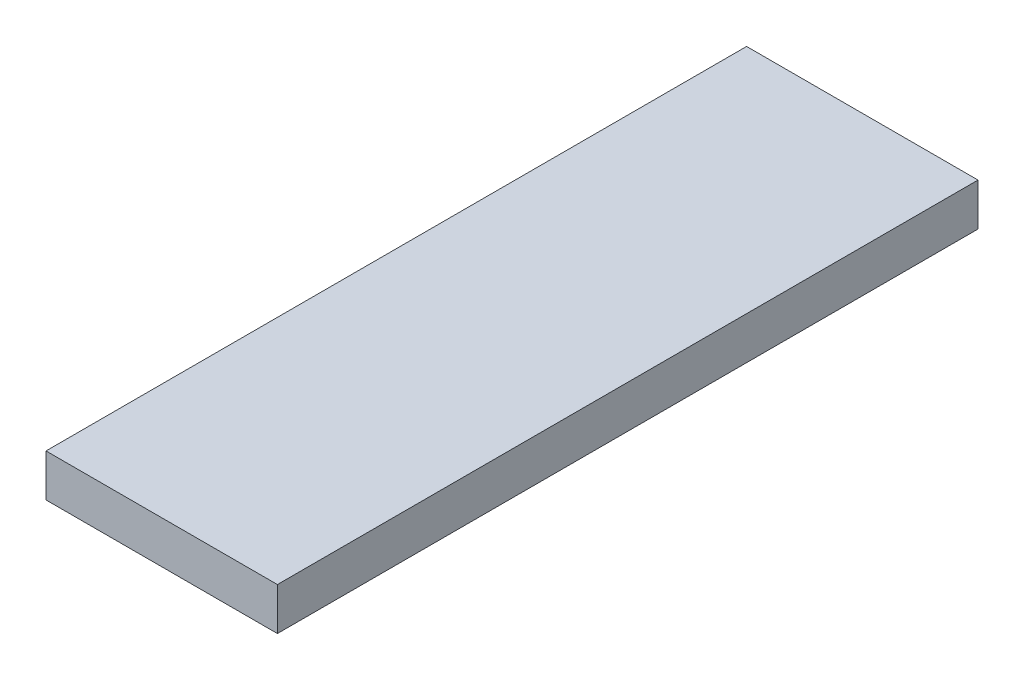
from build123d import *

# Parameters (mm, degrees)
SKETCH1_W           = 54.5
SKETCH1_H           = 165
BOSS_EXTRUDE1_DEPTH = 10


with BuildPart() as part:
    # Sketch1 → Boss-Extrude1 (new body)
    with BuildSketch(Plane(origin=(0, 0, 0), x_dir=(1, 0, 0), z_dir=(0, 1, 0))):
        with Locations((27.25, 82.5)):
            Rectangle(SKETCH1_W, SKETCH1_H)
    extrude(amount=BOSS_EXTRUDE1_DEPTH)


solid = part.part
